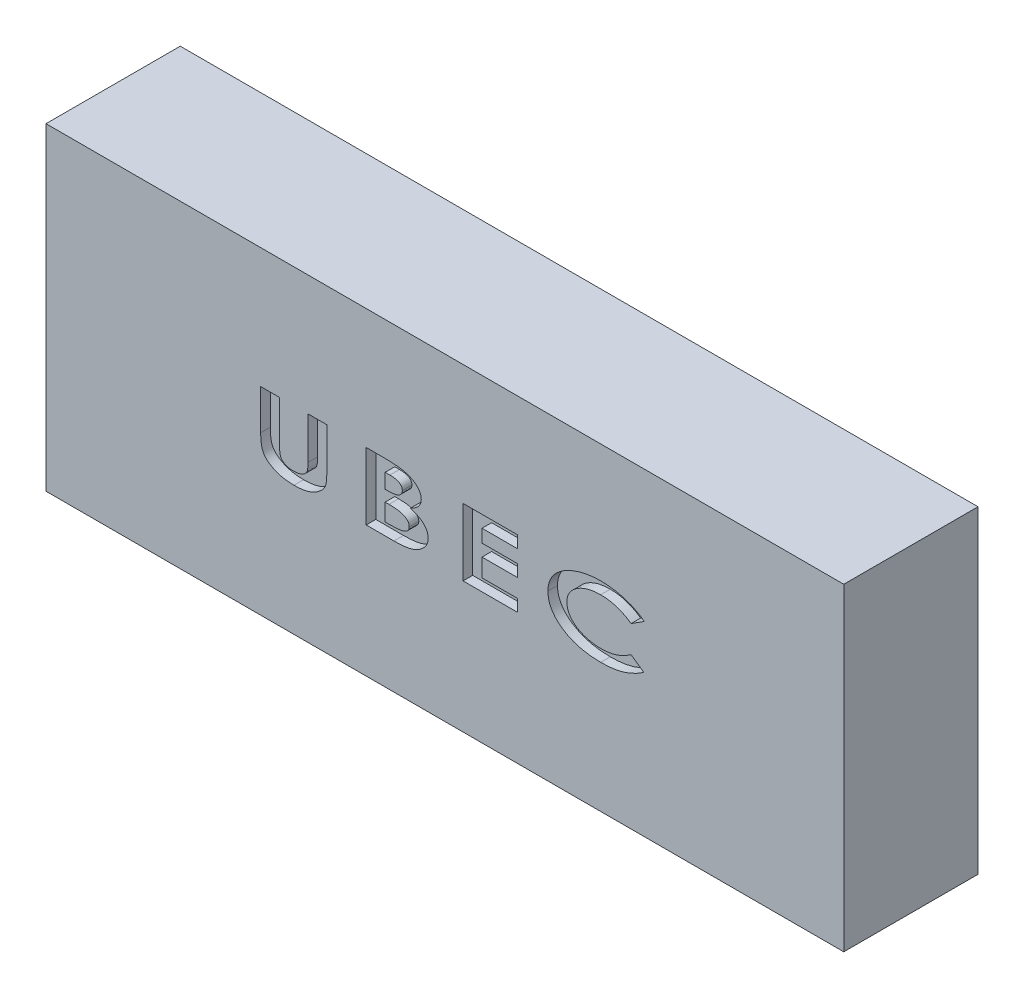
from build123d import *

# Parameters (mm, degrees)
ESBO_O1_W                = 41.6
ESBO_O1_H                = 16.6
RESSALTO_EXTRUS_O1_DEPTH = 7
CORTE_EXTRUS_O1_DEPTH    = 0.5


with BuildPart() as part:
    # Esboço1 → Ressalto-extrusão1 (new body)
    with BuildSketch(Plane.XY):
        Rectangle(ESBO_O1_W, ESBO_O1_H)
    extrude(amount=RESSALTO_EXTRUS_O1_DEPTH)

    # Esboço2 → Corte-extrusão1 (cut)
    # profile 1 of 4: a face of its own
    with BuildSketch(Plane.XY.offset(7)):
        with BuildLine():
            Line((-9.604799721, 2.025972239), (-8.617620234, 2.025972239))
            Line((-8.617620234, 2.025972239), (-8.617620234, -0.251271351))
            add(Edge.make_bspline(
                [(-8.617620234, -0.251271351), (-8.617312523, -0.274879806), (-8.616718078, -0.320487235), (-8.613293339, -0.385982342), (-8.607659843, -0.446090651), (-8.600298331, -0.500955813), (-8.589776163, -0.550579386), (-8.577327018, -0.594930783), (-8.56277799, -0.633774885), (-8.539988619, -0.678574557), (-8.503027702, -0.728198393), (-8.446712475, -0.779765842), (-8.379808559, -0.826364969), (-8.300748139, -0.865212218), (-8.211719643, -0.896329865), (-8.113594015, -0.919713292), (-8.00658213, -0.932570631), (-7.932423335, -0.934544949), (-7.894062542, -0.935566223)],
                knots=[0, 0, 0, 0, 0.97680392, 1.887015294, 2.712549103, 3.474227753, 4.175911338, 4.809461978, 5.378727877, 5.889013684, 6.885011948, 7.918013081, 9.03653674, 10.24734094, 11.550168854, 12.931578206, 14.412769561, 16, 16, 16, 16], degree=3))
            add(Edge.make_bspline(
                [(-7.894062542, -0.935566223), (-7.853338619, -0.934774259), (-7.774613936, -0.93324329), (-7.661002371, -0.917244781), (-7.555854511, -0.892759471), (-7.460810314, -0.856843909), (-7.376820787, -0.814078924), (-7.305815871, -0.764933703), (-7.248205568, -0.710444385), (-7.210928466, -0.658472199), (-7.189573638, -0.610701164), (-7.174702767, -0.568633086), (-7.163199512, -0.518966657), (-7.153601221, -0.462526), (-7.14598337, -0.398878889), (-7.140306135, -0.328254804), (-7.137984479, -0.250350824), (-7.137239469, -0.196116782), (-7.136851003, -0.167837857)],
                knots=[0, 0, 0, 0, 1.543525936, 2.983838047, 4.342526032, 5.629956782, 6.827175666, 7.909124344, 8.893310956, 9.822771358, 10.310595358, 10.87404869, 11.512540546, 12.241142759, 13.044809231, 13.942843694, 14.927349562, 16, 16, 16, 16], degree=3))
            Line((-7.136851003, -0.167837857), (-7.136851003, 2.025972239))
            Line((-7.136851003, 2.025972239), (-6.149671516, 2.025972239))
            Line((-6.149671516, 2.025972239), (-6.149671516, -0.061968466))
            add(Edge.make_bspline(
                [(-6.149671516, -0.061968466), (-6.149889457, -0.104275307), (-6.150308598, -0.185639436), (-6.154890016, -0.302499101), (-6.160417913, -0.40944622), (-6.17068498, -0.505940465), (-6.181785237, -0.592706545), (-6.197567638, -0.669101687), (-6.214340442, -0.735920317), (-6.241944881, -0.812341805), (-6.289086174, -0.900090621), (-6.362448237, -1.000990258), (-6.456846484, -1.098471258), (-6.567975955, -1.193493956), (-6.693513911, -1.281417595), (-6.830169618, -1.359115675), (-6.976629944, -1.423557311), (-7.132982191, -1.475630319), (-7.300241938, -1.515689397), (-7.479926936, -1.542833969), (-7.672366343, -1.561086597), (-7.805208393, -1.562857762), (-7.87373001, -1.563771351)],
                knots=[0, 0, 0, 0, 0.958894092, 1.844136372, 2.650756596, 3.385554808, 4.043333162, 4.632397345, 5.15278767, 5.603567868, 6.470811374, 7.400099686, 8.423053263, 9.538902131, 10.710222176, 11.891633105, 13.096470395, 14.331090783, 15.622383113, 16.989747196, 18.447273378, 20, 20, 20, 20], degree=3))
            add(Edge.make_bspline(
                [(-7.87373001, -1.563771351), (-7.919318375, -1.563272972), (-8.008938783, -1.562293229), (-8.141065968, -1.553370818), (-8.268631248, -1.540527715), (-8.391923686, -1.521392539), (-8.510657912, -1.497215779), (-8.624871851, -1.466916541), (-8.734303987, -1.431022458), (-8.838989984, -1.390706307), (-8.937802687, -1.346012428), (-9.029466325, -1.297427905), (-9.114617852, -1.247315595), (-9.192067014, -1.194039969), (-9.261821321, -1.137434347), (-9.325192461, -1.078932617), (-9.380829163, -1.016979586), (-9.429860435, -0.951198061), (-9.4722437, -0.8780354), (-9.507431987, -0.794440593), (-9.53867322, -0.700115143), (-9.562089005, -0.594021443), (-9.582295132, -0.477126054), (-9.594584772, -0.348698273), (-9.603439034, -0.209094872), (-9.604334863, -0.112231967), (-9.604799721, -0.061968466)],
                knots=[0, 0, 0, 0, 1.238610546, 2.434936635, 3.597011112, 4.72150031, 5.823730594, 6.888137958, 7.930415606, 8.951723426, 9.935069148, 10.875331176, 11.769491529, 12.618562483, 13.426875778, 14.208685577, 14.959685766, 15.68620222, 16.434512572, 17.250868489, 18.146538507, 19.130888511, 20.19996489, 21.368355742, 22.634403422, 24, 24, 24, 24], degree=3))
            Line((-9.604799721, -0.061968466), (-9.604799721, 2.025972239))
        make_face()
    # profile 2 of 4: a face of its own
    with BuildSketch(Plane.XY.offset(7)):
        with BuildLine():
            Line((-4.10351767, -1.474027761), (-4.10351767, 2.025972239))
            Line((-4.10351767, 2.025972239), (-3.287411901, 2.025972239))
            add(Edge.make_bspline(
                [(-3.287411901, 2.025972239), (-3.230151036, 2.025983653), (-3.119823801, 2.026005645), (-2.960197047, 2.022086642), (-2.812723261, 2.017232108), (-2.676855515, 2.011509085), (-2.553013227, 2.002024935), (-2.440980036, 1.991922659), (-2.340827474, 1.979625681), (-2.278461067, 1.968716782), (-2.249050522, 1.963572399)],
                knots=[0, 0, 0, 0, 1.31948929, 2.542322856, 3.679315054, 4.719870347, 5.675693744, 6.541172342, 7.312050872, 8, 8, 8, 8], degree=3))
            add(Edge.make_bspline(
                [(-2.249050522, 1.963572399), (-2.211094887, 1.95629226), (-2.136610894, 1.942005743), (-2.028816057, 1.913686153), (-1.926947039, 1.881594381), (-1.831048484, 1.845149198), (-1.74104674, 1.803773347), (-1.656961227, 1.757561745), (-1.578835414, 1.70706523), (-1.507334142, 1.652437827), (-1.442798805, 1.594560341), (-1.386434953, 1.533692523), (-1.339038125, 1.469809954), (-1.299249596, 1.403942362), (-1.268861116, 1.334868386), (-1.248076917, 1.26313631), (-1.233819641, 1.189162341), (-1.232427035, 1.138653735), (-1.231722798, 1.113111662)],
                knots=[0, 0, 0, 0, 1.288638081, 2.528818454, 3.714528151, 4.849421997, 5.948001761, 7.015476048, 8.046736511, 9.047591826, 10.013384564, 10.934618588, 11.80916513, 12.662011224, 13.496166577, 14.3174033, 15.149115171, 16, 16, 16, 16], degree=3))
            add(Edge.make_bspline(
                [(-1.231722798, 1.113111662), (-1.233387481, 1.080250192), (-1.236692941, 1.014999163), (-1.261931528, 0.919432379), (-1.305263756, 0.829409756), (-1.364363062, 0.743119881), (-1.443089934, 0.661373799), (-1.541639035, 0.58303365), (-1.660971596, 0.507489982), (-1.749438701, 0.46241835), (-1.796125843, 0.438632495)],
                knots=[0, 0, 0, 0, 0.846570316, 1.680983366, 2.527232041, 3.411263011, 4.365891141, 5.441371359, 6.649723432, 8, 8, 8, 8], degree=3))
            add(Edge.make_bspline(
                [(-1.796125843, 0.438632495), (-1.757458303, 0.426086226), (-1.68220533, 0.40166926), (-1.574344621, 0.361012395), (-1.474261229, 0.318355762), (-1.382487522, 0.272944015), (-1.298741642, 0.225088124), (-1.222549956, 0.175695744), (-1.155102864, 0.12277178), (-1.095051299, 0.068152944), (-1.042793876, 0.010664999), (-0.996660621, -0.048628385), (-0.959120523, -0.111684949), (-0.926716087, -0.176203009), (-0.903357849, -0.24406019), (-0.88545014, -0.313853701), (-0.874706776, -0.386489201), (-0.873407432, -0.435864772), (-0.872748439, -0.460906767)],
                knots=[0, 0, 0, 0, 1.404636823, 2.733638992, 3.981780949, 5.162825121, 6.269721482, 7.313539045, 8.297398225, 9.229093884, 10.115148496, 10.979328281, 11.820057026, 12.647176798, 13.469670561, 14.294302631, 15.134914998, 16, 16, 16, 16], degree=3))
            add(Edge.make_bspline(
                [(-0.872748439, -0.460906767), (-0.873411094, -0.48501835), (-0.87472989, -0.53300454), (-0.885706581, -0.604158302), (-0.90303699, -0.673757969), (-0.928213469, -0.74164923), (-0.959163361, -0.808396499), (-0.999632401, -0.872264812), (-1.044759405, -0.935662326), (-1.097522231, -0.996251292), (-1.155563012, -1.054147372), (-1.217813433, -1.108789089), (-1.284206814, -1.159442234), (-1.354365178, -1.206830217), (-1.429538199, -1.249122868), (-1.508158777, -1.288426057), (-1.590534168, -1.324644375), (-1.678236666, -1.356087413), (-1.771932964, -1.384571923), (-1.873749945, -1.407830435), (-1.983259281, -1.429386196), (-2.101855598, -1.444610916), (-2.22848857, -1.458427436), (-2.363708653, -1.46696845), (-2.507245774, -1.472792493), (-2.605681283, -1.473607705), (-2.656402285, -1.474027761)],
                knots=[0, 0, 0, 0, 0.763234275, 1.518967293, 2.274700312, 3.030976776, 3.808996623, 4.599830996, 5.421511535, 6.271665876, 7.140431499, 8.016324575, 8.892686587, 9.783586145, 10.69518197, 11.621974588, 12.56662274, 13.542952754, 14.570884772, 15.665980933, 16.849012928, 18.104034293, 19.451034968, 20.882727707, 22.393758769, 24, 24, 24, 24], degree=3))
            Line((-2.656402285, -1.474027761), (-4.10351767, -1.474027761))
        make_face()
        with BuildLine():
            Line((-3.116338183, 1.397767111), (-3.116338183, 0.634946598))
            Line((-3.116338183, 0.634946598), (-2.907403888, 0.634946598))
            add(Edge.make_bspline(
                [(-2.907403888, 0.634946598), (-2.879116682, 0.635134264), (-2.82459877, 0.635495954), (-2.745517396, 0.640551426), (-2.672197416, 0.648572975), (-2.604410118, 0.660830135), (-2.542120846, 0.674944222), (-2.48541013, 0.693415675), (-2.434384776, 0.714792281), (-2.388937459, 0.739676585), (-2.348783846, 0.766861981), (-2.313870409, 0.797029705), (-2.285519217, 0.830603831), (-2.259899484, 0.864632615), (-2.241897328, 0.902724287), (-2.228358423, 0.942667642), (-2.220639686, 0.985216049), (-2.219487997, 1.014224366), (-2.218902285, 1.028977047)],
                knots=[0, 0, 0, 0, 1.531470513, 2.951601988, 4.289032099, 5.522818593, 6.680046859, 7.744576757, 8.7482429, 9.671368044, 10.545391607, 11.370400094, 12.159694004, 12.921734149, 13.668811109, 14.429168115, 15.201126318, 16, 16, 16, 16], degree=3))
            add(Edge.make_bspline(
                [(-2.218902285, 1.028977047), (-2.219560246, 1.042784082), (-2.220851137, 1.069872917), (-2.22746792, 1.109497929), (-2.240797343, 1.146502509), (-2.257850935, 1.181941243), (-2.281996853, 1.21404237), (-2.308966193, 1.245567705), (-2.342634669, 1.273309946), (-2.380462966, 1.299442601), (-2.423576087, 1.322490045), (-2.471667913, 1.342883724), (-2.525089933, 1.360423691), (-2.583994684, 1.374223661), (-2.647996557, 1.384488894), (-2.717021439, 1.392106671), (-2.791408136, 1.397231369), (-2.842891538, 1.39758437), (-2.869543311, 1.397767111)],
                knots=[0, 0, 0, 0, 0.794923146, 1.559606406, 2.299305798, 3.050759689, 3.811771406, 4.602135162, 5.431762038, 6.311701388, 7.243988896, 8.237728068, 9.313205348, 10.473932854, 11.713699693, 13.039329106, 14.467328779, 16, 16, 16, 16], degree=3))
            Line((-2.869543311, 1.397767111), (-3.116338183, 1.397767111))
        make_face(mode=Mode.SUBTRACT)
        with BuildLine():
            Line((-3.116338183, 0.051613265), (-3.116338183, -0.845822633))
            Line((-3.116338183, -0.845822633), (-2.875152285, -0.845822633))
            add(Edge.make_bspline(
                [(-2.875152285, -0.845822633), (-2.827238376, -0.845626796), (-2.735589102, -0.845252202), (-2.604171101, -0.840438391), (-2.484940397, -0.831974593), (-2.377738217, -0.821254499), (-2.282653211, -0.806775929), (-2.199978, -0.788735093), (-2.129112709, -0.76821048), (-2.06954719, -0.743513478), (-2.020005114, -0.714827766), (-1.976957362, -0.684659588), (-1.940774436, -0.650716886), (-1.911271011, -0.613610445), (-1.888153173, -0.573473205), (-1.872143837, -0.530336545), (-1.861972411, -0.484276655), (-1.860618371, -0.452546951), (-1.859927926, -0.436367505)],
                knots=[0, 0, 0, 0, 1.900664809, 3.635573708, 5.215581466, 6.641794037, 7.908444062, 9.028674666, 9.996605344, 10.831724618, 11.579184148, 12.263551699, 12.912859337, 13.539807459, 14.137775083, 14.742176496, 15.358617136, 16, 16, 16, 16], degree=3))
            add(Edge.make_bspline(
                [(-1.859927926, -0.436367505), (-1.86042891, -0.417825547), (-1.861410431, -0.381498337), (-1.874272652, -0.328948138), (-1.893090007, -0.279185187), (-1.920027259, -0.232515476), (-1.955089306, -0.189346411), (-1.997627993, -0.1492068), (-2.047888573, -0.112062125), (-2.105776115, -0.077565874), (-2.172528871, -0.046320794), (-2.249260503, -0.020189856), (-2.335771076, 0.002132264), (-2.432354747, 0.019890217), (-2.53896674, 0.034936635), (-2.656051623, 0.043880805), (-2.782993506, 0.050606114), (-2.870935017, 0.051269438), (-2.916518471, 0.051613265)],
                knots=[0, 0, 0, 0, 0.690419058, 1.352661837, 2.007046633, 2.671296647, 3.353736276, 4.075560012, 4.848333838, 5.681504583, 6.586748777, 7.593567271, 8.702088903, 9.918335251, 11.256676684, 12.718365048, 14.299002886, 16, 16, 16, 16], degree=3))
            Line((-2.916518471, 0.051613265), (-3.116338183, 0.051613265))
        make_face(mode=Mode.SUBTRACT)
    # profile 3 of 4: a face of its own
    with BuildSketch(Plane.XY.offset(7)):
        Polygon((0.949046433, 2.025972239), (3.77596951, 2.025972239), (3.77596951, 1.397767111), (1.93622592, 1.397767111), (1.93622592, 0.724690188), (3.77596951, 0.724690188), (3.77596951, 0.096485059), (1.93622592, 0.096485059), (1.93622592, -0.845822633), (3.77596951, -0.845822633), (3.77596951, -1.474027761), (0.949046433, -1.474027761), align=None)
    # profile 4 of 4: a face of its own
    with BuildSketch(Plane.XY.offset(7)):
        with BuildLine():
            Line((10.399046433, 1.418800765), (9.708441465, 0.978496277))
            add(Edge.make_bspline(
                [(9.708441465, 0.978496277), (9.649443443, 1.019155192), (9.532350033, 1.099850967), (9.347368057, 1.203733297), (9.156318744, 1.29055458), (8.960569352, 1.363673736), (8.758574018, 1.418591284), (8.55148734, 1.458865867), (8.338804391, 1.483284825), (8.195016583, 1.486094017), (8.122503965, 1.4875107)],
                knots=[0, 0, 0, 0, 1.014837834, 2.014149296, 3.001006005, 3.985821711, 4.971527747, 5.963194959, 6.972833183, 8, 8, 8, 8], degree=3))
            add(Edge.make_bspline(
                [(8.122503965, 1.4875107), (8.061705984, 1.486409177), (7.942462038, 1.484248743), (7.76719849, 1.467990806), (7.599294578, 1.440563212), (7.438320189, 1.403166671), (7.284950719, 1.353633478), (7.138543782, 1.294387584), (6.99998566, 1.222982024), (6.869908979, 1.142580442), (6.751102983, 1.054267989), (6.64668025, 0.959907795), (6.558858224, 0.859508301), (6.486605856, 0.75444293), (6.429509306, 0.644187375), (6.389555246, 0.528242214), (6.364709564, 0.407206229), (6.361970121, 0.324702346), (6.360584894, 0.282983457)],
                knots=[0, 0, 0, 0, 1.236486871, 2.42513932, 3.576244643, 4.694644103, 5.783012074, 6.851105052, 7.903437657, 8.949470909, 9.958158844, 10.910384425, 11.806511063, 12.66483807, 13.498201328, 14.323513631, 15.152268394, 16, 16, 16, 16], degree=3))
            add(Edge.make_bspline(
                [(6.360584894, 0.282983457), (6.361235311, 0.253736838), (6.362519645, 0.19598558), (6.373451144, 0.110613402), (6.390804197, 0.027765587), (6.415494675, -0.05246922), (6.447118479, -0.130294083), (6.486881319, -0.205156978), (6.532313408, -0.278378934), (6.584985039, -0.348626895), (6.644825488, -0.414970998), (6.710185821, -0.4782169), (6.781286932, -0.538117167), (6.858302169, -0.59384225), (6.941036827, -0.646359311), (7.029928747, -0.694105337), (7.124325721, -0.739326433), (7.223966717, -0.780495196), (7.32855772, -0.816572413), (7.43600176, -0.849019404), (7.546551016, -0.875581574), (7.659845596, -0.897115263), (7.775767884, -0.915042549), (7.894940993, -0.926343295), (8.016513334, -0.934776615), (8.098650442, -0.935301686), (8.14003201, -0.935566223)],
                knots=[0, 0, 0, 0, 0.878315556, 1.734348478, 2.581205271, 3.418461663, 4.252887286, 5.100791162, 5.961847879, 6.839461624, 7.734455547, 8.643087164, 9.569900467, 10.524847464, 11.496806173, 12.511564499, 13.554163719, 14.640251063, 15.748243195, 16.876667468, 18.010778071, 19.161907593, 20.340521615, 21.533043374, 22.757120452, 24, 24, 24, 24], degree=3))
            add(Edge.make_bspline(
                [(8.14003201, -0.935566223), (8.210192801, -0.934208704), (8.347778418, -0.931546605), (8.549598695, -0.9109811), (8.742040027, -0.876825482), (8.896691884, -0.836528724), (9.017905221, -0.796677955), (9.109809371, -0.759355708), (9.204561081, -0.718366857), (9.30126365, -0.671093536), (9.400422608, -0.618656444), (9.501033443, -0.559115762), (9.604955526, -0.495996648), (9.673558848, -0.449959985), (9.708441465, -0.4265518)],
                knots=[0, 0, 0, 0, 1.505063555, 2.951436218, 4.347093681, 5.694607453, 6.37641358, 7.083116245, 7.821840473, 8.591025978, 9.391806723, 10.22770291, 11.098843068, 12, 12, 12, 12], degree=3))
            Line((9.708441465, -0.4265518), (10.378012779, -0.89560228))
            add(Edge.make_bspline(
                [(10.378012779, -0.89560228), (10.330488489, -0.92599105), (10.23714105, -0.985680816), (10.096789234, -1.069658433), (9.957617208, -1.144954895), (9.821123444, -1.215007521), (9.68601953, -1.276498178), (9.552788008, -1.330589986), (9.422090759, -1.378696906), (9.291779793, -1.41865134), (9.160650462, -1.453639177), (9.025791251, -1.482735531), (8.886702467, -1.508091611), (8.742821119, -1.528247594), (8.594835188, -1.544490647), (8.442107762, -1.555356946), (8.285005194, -1.562812856), (8.178602783, -1.563448688), (8.12460733, -1.563771351)],
                knots=[0, 0, 0, 0, 1.133034675, 2.225512122, 3.28425737, 4.310857163, 5.306587224, 6.264611791, 7.198679476, 8.102922904, 9.001310792, 9.923925246, 10.873250138, 11.8405114, 12.841538757, 13.862963098, 14.915529496, 16, 16, 16, 16], degree=3))
            add(Edge.make_bspline(
                [(8.12460733, -1.563771351), (8.074819929, -1.56338982), (7.976139677, -1.562633614), (7.83003689, -1.555931241), (7.687151388, -1.546409224), (7.547792102, -1.532349277), (7.411888878, -1.514357433), (7.279664354, -1.491459215), (7.150568964, -1.46618192), (7.025204947, -1.434823896), (6.902759106, -1.400715928), (6.784048083, -1.362070824), (6.668401234, -1.320348999), (6.557034708, -1.272736871), (6.448326079, -1.222872059), (6.343484289, -1.167711971), (6.24205798, -1.108873133), (6.143927855, -1.046921139), (6.051191806, -0.980897136), (5.963090551, -0.91356805), (5.882778229, -0.841838042), (5.806410456, -0.770143549), (5.736873095, -0.694914406), (5.674014882, -0.617128556), (5.616605113, -0.537469113), (5.565669953, -0.45531321), (5.519516287, -0.371461699), (5.48151758, -0.284433949), (5.446939409, -0.196241185), (5.420894042, -0.104733414), (5.399703211, -0.011355337), (5.384227399, 0.084149346), (5.374818489, 0.182064039), (5.373880251, 0.248140046), (5.373405407, 0.281581213)],
                knots=[0, 0, 0, 0, 1.298272765, 2.573218945, 3.813355947, 5.032285749, 6.225204, 7.387463167, 8.531312365, 9.654715901, 10.756418465, 11.845370433, 12.909672022, 13.961228707, 15.002830252, 16.027824345, 17.049115466, 18.060171851, 19.052764301, 20.017055926, 20.949864095, 21.859426769, 22.747855794, 23.618782832, 24.466125739, 25.306602467, 26.13834979, 26.959512911, 27.781263853, 28.606712941, 29.437656039, 30.277292666, 31.128135197, 32, 32, 32, 32], degree=3))
            add(Edge.make_bspline(
                [(5.373405407, 0.281581213), (5.374540085, 0.324629659), (5.376792742, 0.41009304), (5.393043478, 0.536194757), (5.420637716, 0.658679376), (5.459239494, 0.777179504), (5.50882765, 0.892347451), (5.568817474, 1.003938489), (5.641474771, 1.110882354), (5.723372186, 1.214769179), (5.815880042, 1.314316321), (5.919049756, 1.408120674), (6.030339818, 1.498123238), (6.151665147, 1.582363599), (6.282371044, 1.66163407), (6.422754966, 1.735738212), (6.572346537, 1.805085367), (6.730220383, 1.869353845), (6.894512433, 1.927018904), (7.06295665, 1.977583098), (7.234448022, 2.020378579), (7.409143122, 2.055741876), (7.587340795, 2.081763327), (7.768289073, 2.101897819), (7.952460769, 2.112940828), (8.076216709, 2.114785511), (8.138629766, 2.115715829)],
                knots=[0, 0, 0, 0, 0.844920481, 1.677406957, 2.490983168, 3.306316564, 4.120138491, 4.949433411, 5.789206918, 6.654713178, 7.544144716, 8.45328191, 9.389708224, 10.351841593, 11.350269443, 12.388695374, 13.466250278, 14.585668395, 15.73335429, 16.882863371, 18.036694394, 19.201815689, 20.380040705, 21.57059791, 22.774794871, 24, 24, 24, 24], degree=3))
            add(Edge.make_bspline(
                [(8.138629766, 2.115715829), (8.191927248, 2.115192807), (8.297887576, 2.114152991), (8.456193678, 2.105292075), (8.612966912, 2.091791208), (8.768106658, 2.070793699), (8.921945875, 2.046194249), (9.0739721, 2.013996277), (9.225065187, 1.978078757), (9.373639012, 1.935099391), (9.519273814, 1.887871216), (9.660120092, 1.83498127), (9.79666526, 1.778608867), (9.927367391, 1.715947552), (10.053321333, 1.649620304), (10.173472894, 1.577464246), (10.28940726, 1.501772963), (10.362658325, 1.446338379), (10.399046433, 1.418800765)],
                knots=[0, 0, 0, 0, 1.062830169, 2.113004761, 3.161181315, 4.200052587, 5.234470853, 6.267386496, 7.298354938, 8.331018179, 9.350960357, 10.350877049, 11.330724794, 12.295975716, 13.24047885, 14.168496878, 15.090184807, 16, 16, 16, 16], degree=3))
        make_face()
    extrude(amount=-CORTE_EXTRUS_O1_DEPTH, mode=Mode.SUBTRACT)


solid = part.part
